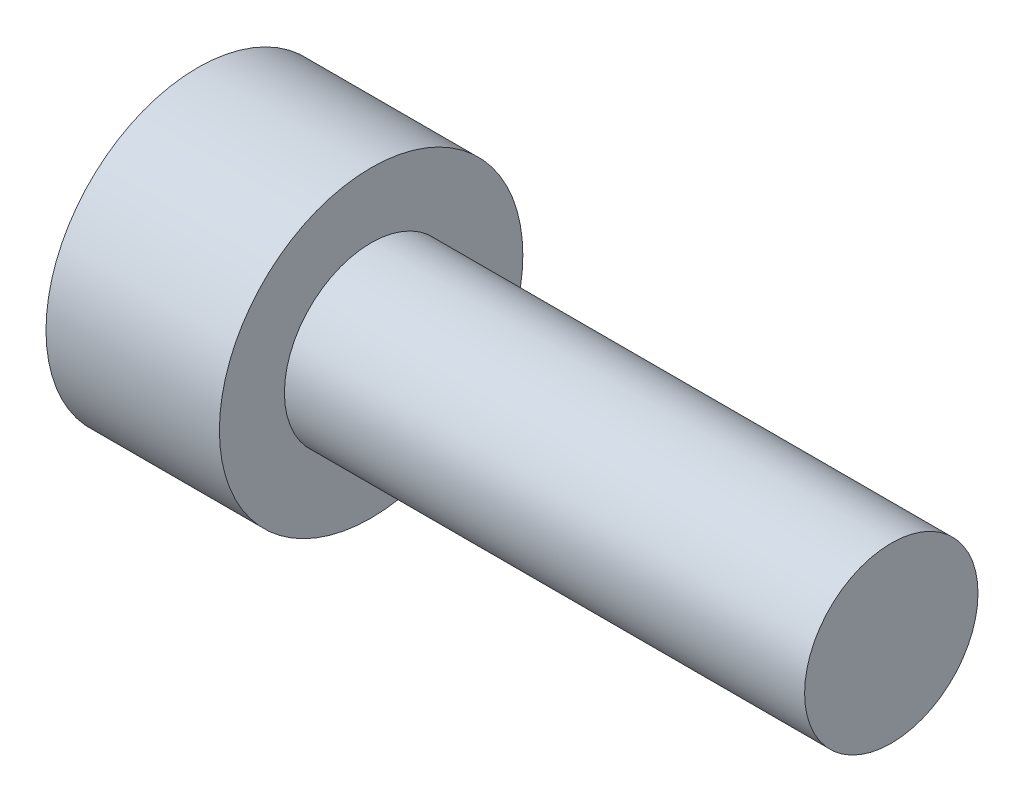
from build123d import *

# Parameters (mm, degrees)
SKETCH_1_R          = 3.5
EXTRUDE_1_DEPTH     = 4
CUT_EXTRUDE_1_DEPTH = 2
SKETCH_3_R          = 2
EXTRUDE_2_DEPTH     = 12


with BuildPart() as part:
    # 草图1 → 凸台-拉伸1 (new body)
    with BuildSketch(Plane(origin=(0, 0, 0), x_dir=(0, 0, -1), z_dir=(1, 0, 0))):
        Circle(SKETCH_1_R)
    extrude(amount=EXTRUDE_1_DEPTH)

    # 草图2 → 切除-拉伸1 (cut)
    with BuildSketch(Plane.ZY):
        Polygon((1.525, -0.880459161), (1.525, 0.880459161), (0, 1.760918321), (-1.525, 0.880459161), (-1.525, -0.880459161), (0, -1.760918321), align=None)
    extrude(amount=-CUT_EXTRUDE_1_DEPTH, mode=Mode.SUBTRACT)

    # 草图3 → 凸台-拉伸2 (add)
    with BuildSketch(Plane(origin=(4, 0, 0), x_dir=(0, 0, -1), z_dir=(1, 0, 0))):
        Circle(SKETCH_3_R)
    extrude(amount=EXTRUDE_2_DEPTH)


solid = part.part
